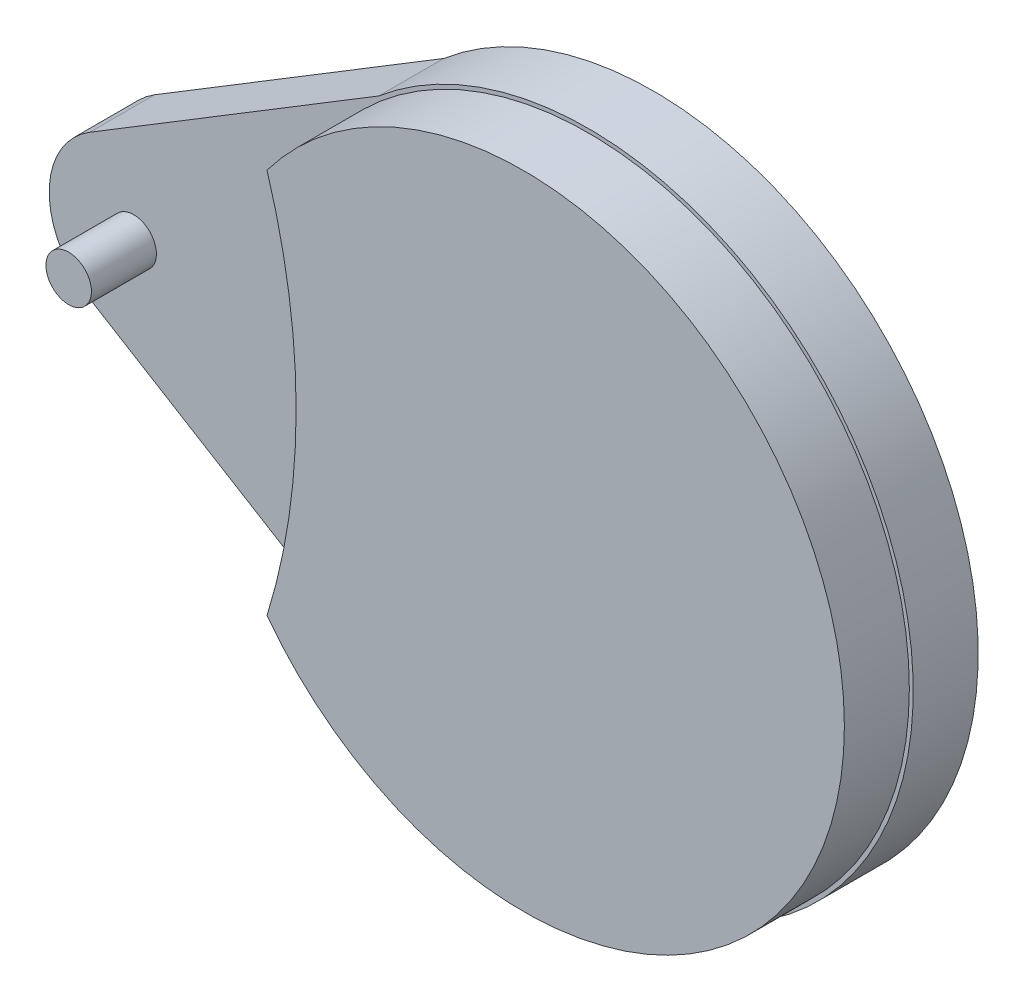
from build123d import *

# Parameters (mm, degrees)
BOSS_EXTRUDE1_DEPTH = 5
SKETCH1_4_R         = 1.75
BOSS_EXTRUDE2_DEPTH = 5


with BuildPart() as part:
    # Sketch1 → Boss-Extrude1 (new body)
    with BuildSketch(Plane.XY):
        with BuildLine():
            ThreePointArc((51.653935363, -19.09000623), (92.796167617, 0), (51.653935363, 19.09000623))
            Line((51.653935363, 19.09000623), (29.416167617, 5.552080691))
            ThreePointArc((29.416167617, 5.552080691), (26.296167617, 0), (29.416167617, -5.552080691))
            Line((29.416167617, -5.552080691), (51.653935363, -19.09000623))
        make_face()
    extrude(amount=-BOSS_EXTRUDE1_DEPTH)

    # Sketch1<4> → Boss-Extrude2 (add)
    with BuildSketch(Plane.XY):
        with BuildLine():
            ThreePointArc((48.058176241, -14.849299526), (92.496167617, 0), (48.058176241, 14.849299526))
            ThreePointArc((48.058176241, 14.849299526), (50.3, 0), (48.058176241, -14.849299526))
        make_face()
        with Locations((32.796167617, 0)):
            Circle(SKETCH1_4_R)
    extrude(amount=BOSS_EXTRUDE2_DEPTH)


solid = part.part
